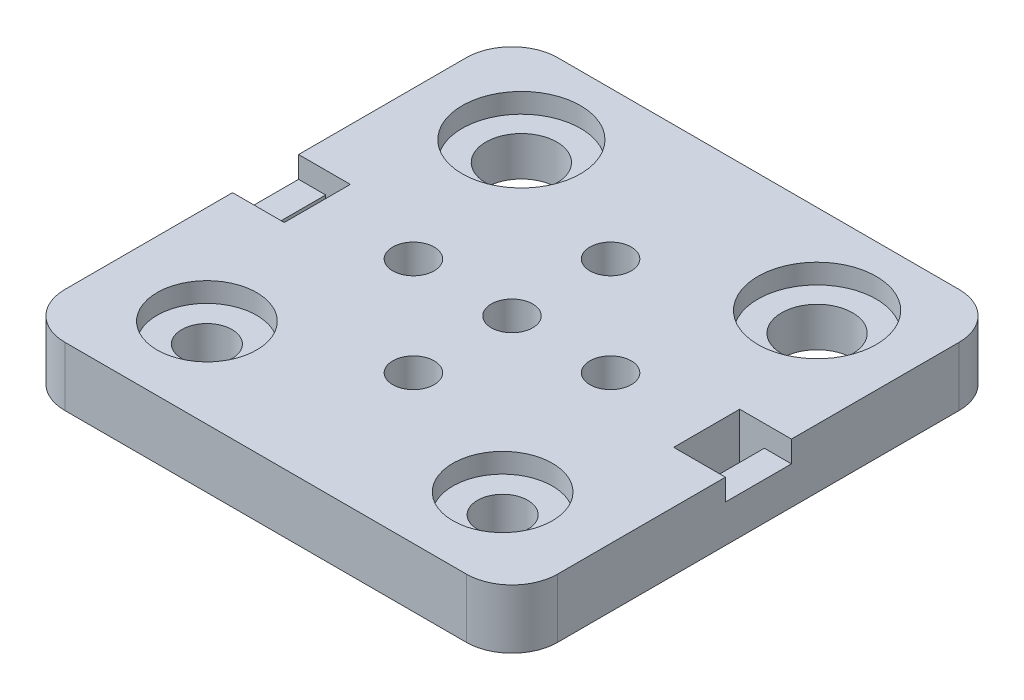
from build123d import *

# Parameters (mm, degrees)
SKETCH1_R             = 3.6
SKETCH1_R_2           = 2.55
BOSS_EXTRUDE1_DEPTH   = 6
M5X0_8_TAPPED_HOLE1_D = 4.2
SKETCH2_R             = 6
SKETCH2_R_2           = 5.05
CUT_EXTRUDE1_DEPTH    = 2
SKETCH5_W             = 5.25
SKETCH5_H             = 6.7
CUT_EXTRUDE2_DEPTH    = 2.18
SKETCH6_W             = 2.5
SKETCH6_H             = 6.7
CUT_EXTRUDE3_DEPTH    = 36.561107969


with BuildPart() as part:
    # Sketch1 → Boss-Extrude1 (new body)
    with BuildSketch(Plane(origin=(0, 0, 0), x_dir=(1, 0, 0), z_dir=(0, 1, 0))):
        with BuildLine():
            Line((20.365, -25), (-20.365, -25))
            ThreePointArc((-20.365, -25), (-23.642439931, -23.642439931), (-25, -20.365))
            Line((-25, -20.365), (-25, 20.365))
            ThreePointArc((-25, 20.365), (-23.642439931, 23.642439931), (-20.365, 25))
            Line((-20.365, 25), (20.365, 25))
            ThreePointArc((20.365, 25), (23.642439931, 23.642439931), (25, 20.365))
            Line((25, 20.365), (25, -20.365))
            ThreePointArc((25, -20.365), (23.642439931, -23.642439931), (20.365, -25))
        make_face()
        with Locations(Location((-15, 15.95, 0), (0, 0, 270))):
            Circle(SKETCH1_R, mode=Mode.SUBTRACT)
        with Locations(Location((15, 15.95, 0), (0, 0, 90))):
            Circle(SKETCH1_R, mode=Mode.SUBTRACT)
        with Locations(Location((15, -15.95, 0), (0, 0, 270))):
            Circle(SKETCH1_R_2, mode=Mode.SUBTRACT)
        with Locations(Location((-15, -15.95, 0), (0, 0, 90))):
            Circle(SKETCH1_R_2, mode=Mode.SUBTRACT)
    extrude(amount=BOSS_EXTRUDE1_DEPTH)

    # M5x0.8 Tapped Hole1 (through all)
    with Locations(Plane(origin=(0, 6, 0), x_dir=(1, 0, 0), z_dir=(0, 1, 0))):
        with Locations((0, 10), (-10, 0), (0, 0), (0, -10), (10, 0)):
            Hole(M5X0_8_TAPPED_HOLE1_D / 2)

    # Sketch2 → Cut-Extrude1 (cut)
    with BuildSketch(Plane(origin=(0, 6, 0), x_dir=(1, 0, 0), z_dir=(0, 1, 0))):
        with Locations(Location((-15, 15.95, 0), (0, 0, 270))):
            Circle(SKETCH2_R)
        with Locations(Location((15, 15.95, 0), (0, 0, 270))):
            Circle(SKETCH2_R)
        with Locations(Location((15, -15.95, 0), (0, 0, 270))):
            Circle(SKETCH2_R_2)
        with Locations(Location((-15, -15.95, 0), (0, 0, 270))):
            Circle(SKETCH2_R_2)
    extrude(amount=-CUT_EXTRUDE1_DEPTH, mode=Mode.SUBTRACT)

    # Sketch5 → Cut-Extrude2 (cut)
    with BuildSketch(Plane(origin=(0, 6, 0), x_dir=(1, 0, 0), z_dir=(0, 1, 0))):
        with Locations((-22.375, 0)):
            Rectangle(SKETCH5_W, SKETCH5_H)
        with Locations((22.375, 0)):
            Rectangle(SKETCH5_W, SKETCH5_H)
    extrude(amount=-CUT_EXTRUDE2_DEPTH, mode=Mode.SUBTRACT)

    # Sketch6 → Cut-Extrude3 (cut, through all)
    with BuildSketch(Plane(origin=(0, 3.82, 0), x_dir=(1, 0, 0), z_dir=(0, 1, 0))):
        with Locations((-21, 0)):
            Rectangle(SKETCH6_W, SKETCH6_H)
        with Locations((21, 0)):
            Rectangle(SKETCH6_W, SKETCH6_H)
    extrude(amount=-CUT_EXTRUDE3_DEPTH, mode=Mode.SUBTRACT)


solid = part.part
